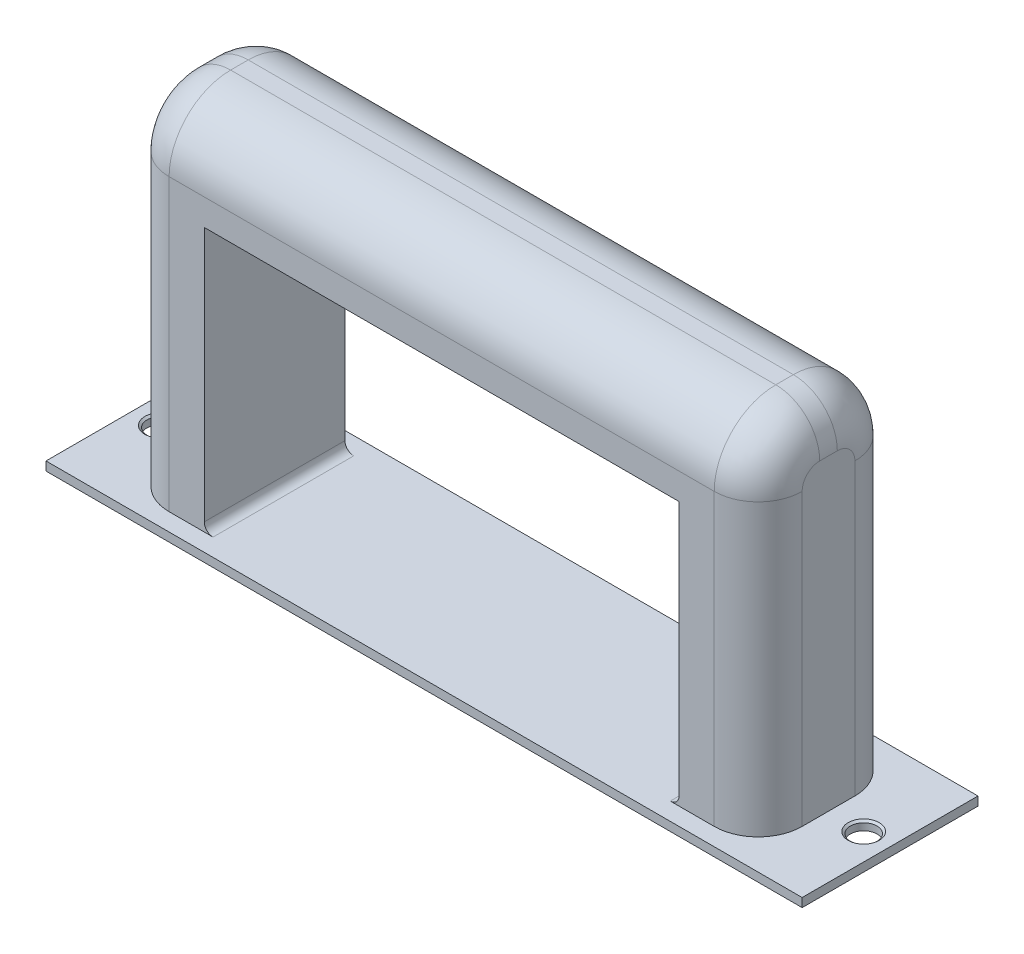
from build123d import *

# Parameters (mm, degrees)
SKETCH2_W                         = 218.44
SKETCH2_H                         = 50.8
SKETCH2_R                         = 3.81
BOSS_EXTRUDE1_DEPTH               = 2.54
SKETCH3_W                         = 182.88
SKETCH3_H                         = 40.64
BOSS_EXTRUDE2_DEPTH               = 101.6
SKETCH5_W                         = 137.16
SKETCH5_H                         = 76.2
CUT_EXTRUDE2_DEPTH                = 101.6
FILLET1_R                         = 17.78
FILLET2_R                         = 17.78
FILLET3_R                         = 12.7
FILLET4_R                         = 12.7
FILLET5_R                         = 2.54
FILLET6_R                         = 2.54
N_0_302_DIAMETER_HOLE1_AT_2_COUNT = 2
N_0_302_DIAMETER_HOLE1_AT_2_PITCH = 203.2


with BuildPart() as part:
    # Sketch2 → Boss-Extrude1 (new body)
    with BuildSketch(Plane(origin=(0, 0, 0), x_dir=(1, 0, 0), z_dir=(0, 1, 0))):
        with Locations((109.22, 25.4)):
            Rectangle(SKETCH2_W, SKETCH2_H)
        with Locations(Location((7.62, 25.4, 0), (0, 0, 270))):
            Circle(SKETCH2_R, mode=Mode.SUBTRACT)
        with Locations(Location((210.82, 25.4, 0), (0, 0, 90))):
            Circle(SKETCH2_R, mode=Mode.SUBTRACT)
    extrude(amount=BOSS_EXTRUDE1_DEPTH)

    # Sketch3 → Boss-Extrude2 (add)
    with BuildSketch(Plane(origin=(0, 2.54, 0), x_dir=(1, 0, 0), z_dir=(0, 1, 0))):
        with Locations((109.22, 25.4)):
            Rectangle(SKETCH3_W, SKETCH3_H)
    extrude(amount=BOSS_EXTRUDE2_DEPTH)

    # Sketch5 → Cut-Extrude2 (cut)
    with BuildSketch(Plane.XY.offset(-5.08)):
        with Locations((109.22, 40.64)):
            Rectangle(SKETCH5_W, SKETCH5_H)
    extrude(amount=-CUT_EXTRUDE2_DEPTH, mode=Mode.SUBTRACT)

    # Fillet1
    fillet1_edges = [part.edges().sort_by_distance(p)[0] for p in [
        (109.22, 104.14, -5.08),
    ]]
    fillet(fillet1_edges, radius=FILLET1_R)

    # Fillet2
    fillet2_edges = [part.edges().sort_by_distance(p)[0] for p in [
        (109.22, 104.14, -45.72),
    ]]
    fillet(fillet2_edges, radius=FILLET2_R)

    # Fillet3
    fillet3_edges = [part.edges().sort_by_distance(p)[0] for p in [
        (17.78, 44.45, -5.08),
        (17.78, 98.932358569, -10.287641431),
        (17.78, 104.14, -25.4),
        (17.78, 44.45, -45.72),
        (17.78, 98.932358569, -40.512358569),
    ]]
    fillet(fillet3_edges, radius=FILLET3_R)

    # Fillet4
    fillet4_edges = [part.edges().sort_by_distance(p)[0] for p in [
        (200.66, 104.14, -25.4),
        (200.66, 44.45, -5.08),
        (200.66, 98.932358569, -10.287641431),
        (200.66, 44.45, -45.72),
        (200.66, 98.932358569, -40.512358569),
    ]]
    fillet(fillet4_edges, radius=FILLET4_R)

    # Fillet5
    fillet5_edges = [part.edges().sort_by_distance(p)[0] for p in [
        (40.64, 2.54, -25.4),
    ]]
    fillet(fillet5_edges, radius=FILLET5_R)

    # Fillet6
    fillet6_edges = [part.edges().sort_by_distance(p)[0] for p in [
        (177.8, 2.54, -25.4),
    ]]
    fillet(fillet6_edges, radius=FILLET6_R)

    # Sketch7 → N (0.302) Diameter Hole1 (revolve, cut)
    with BuildSketch(Plane(origin=(210.82, 2.54, -25.4), x_dir=(0, 0, 1), z_dir=(1, 0, 0))):
        Polygon((0, 0), (0, 2.54), (3.8354, 2.54), (3.8354, 0.532828266), (4.4704, 0), align=None)
    n_0_302_diameter_hole1 = revolve(axis=Axis((210.82, 8.89, -25.4), (0, -1, 0)), mode=Mode.SUBTRACT)

    # N (0.302) Diameter Hole1 at 2: N (0.302) Diameter Hole1 ×2
    with Locations(*[(-i * N_0_302_DIAMETER_HOLE1_AT_2_PITCH, 0, 0) for i in range(1, N_0_302_DIAMETER_HOLE1_AT_2_COUNT)]):
        add(n_0_302_diameter_hole1, mode=Mode.SUBTRACT)


solid = part.part
